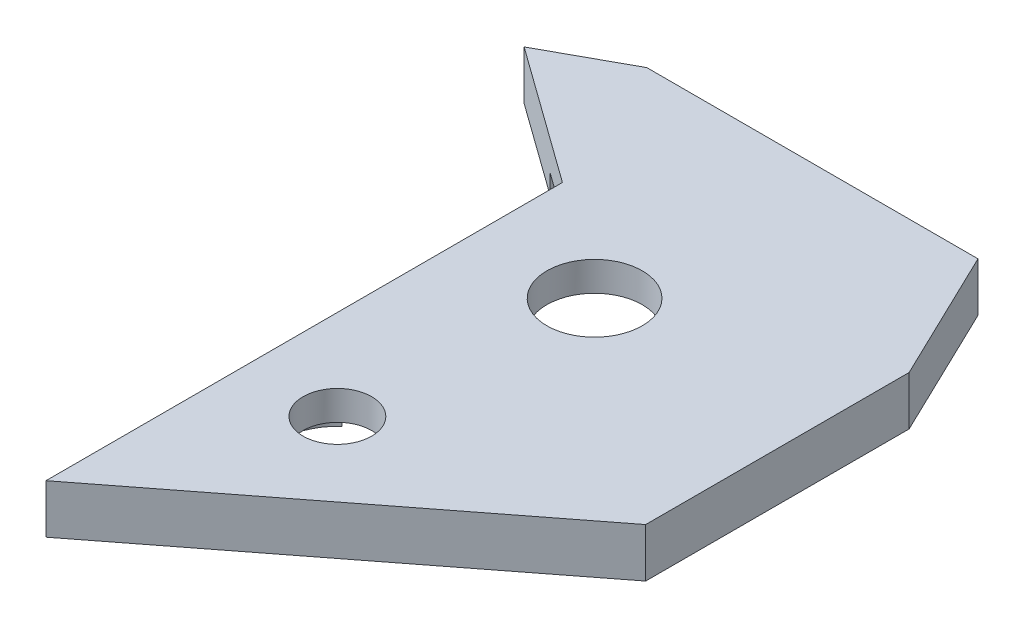
from build123d import *

# Parameters (mm, degrees)
EXTRUDE_1_DEPTH     = 5
CUT_EXTRUDE_1_DEPTH = 2
SKETCH_3_R          = 4.87
SKETCH_3_R_2        = 3.5
CUT_EXTRUDE_2_DEPTH = 80.472580045


with BuildPart() as part:
    # Эскиз1 → Вытянуть1 (new body)
    with BuildSketch(Plane(origin=(0, 0, 0), x_dir=(1, 0, 0), z_dir=(0, 1, 0))):
        Polygon((1e-09, -1e-09), (8.096990259, 4.437064442), (41.925316116, 4.437064442), (48.461562516, -9.134468652), (48.461562516, -36.044162995), (13.950964491, -62.788278664), (13.949330464, -10.03402267), align=None)
    extrude(amount=EXTRUDE_1_DEPTH)

    # Эскиз2 → Вырез-Вытянуть1 (cut)
    with BuildSketch(Plane.XZ):
        with BuildLine():
            ThreePointArc((19.270119717, 37.867537317), (28.134312971, -1.551588069), (27.906130369, 38.851249714))
            ThreePointArc((27.906130369, 38.851249714), (22.488439096, 48.013535902), (19.270119717, 37.867537317))
        make_face()
    extrude(amount=-CUT_EXTRUDE_1_DEPTH, mode=Mode.SUBTRACT)

    # Эскиз3 → Вырез-Вытянуть2 (cut, through all)
    with BuildSketch(Plane(origin=(0, 5, 0), x_dir=(1, 0, 0), z_dir=(0, 1, 0))):
        with Locations(Location((25.834611823, -18.637487181, 0), (0, 0, 270))):
            Circle(SKETCH_3_R)
        with Locations(Location((23.148278256, -42.220808245, 0), (0, 0, 270))):
            Circle(SKETCH_3_R_2)
    extrude(amount=-CUT_EXTRUDE_2_DEPTH, mode=Mode.SUBTRACT)


solid = part.part
